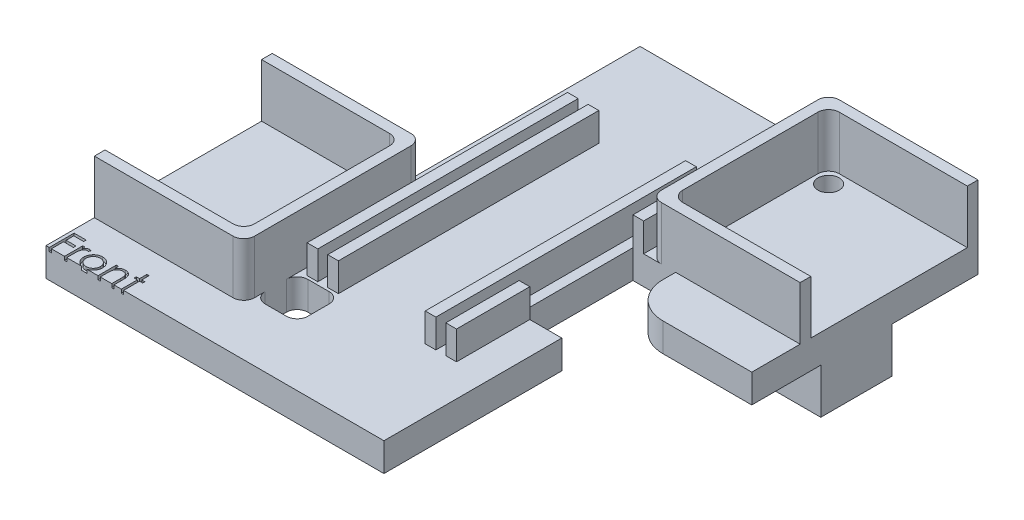
from build123d import *

# Parameters (mm, degrees)
BOSS_EXTRUDE1_DEPTH = 4
BOSS_EXTRUDE2_DEPTH = 7.5
BOSS_EXTRUDE3_DEPTH = 7.5
SKETCH6_R           = 1.5
CUT_EXTRUDE1_DEPTH  = 47.920144927
SKETCH7_W           = 1.5
SKETCH7_H           = 36.6
BOSS_EXTRUDE4_DEPTH = 4
SKETCH8_W           = 6
SKETCH8_H           = 16
CUT_EXTRUDE2_DEPTH  = 48.002659499
SKETCH12_W          = 10
SKETCH12_H          = 10
BOSS_EXTRUDE5_DEPTH = 6.35
CUT_EXTRUDE3_DEPTH  = 48.459166659
CUT_EXTRUDE4_DEPTH  = 0.5
FILLET1_R           = 5


with BuildPart() as part:
    # Sketch1 → Boss-Extrude1 (new body)
    with BuildSketch(Plane(origin=(0, 0, 0), x_dir=(1, 0, 0), z_dir=(0, 1, 0))):
        Polygon((-15, 33), (32.5, 33), (32.5, 1.2), (15, 1.2), (15, -33), (-32.5, -33), (-32.5, -1.2), (-15, -1.2), align=None)
    extrude(amount=BOSS_EXTRUDE1_DEPTH)

    # Sketch2 → Boss-Extrude2 (add)
    with BuildSketch(Plane(origin=(0, 4, 0), x_dir=(1, 0, 0), z_dir=(0, 1, 0))):
        with BuildLine():
            Line((32.5, 31.5), (14.5, 31.5))
            ThreePointArc((14.5, 31.5), (13.439339828, 31.060660172), (13, 30))
            Line((13, 30), (13, 11))
            ThreePointArc((13, 11), (13.439339828, 9.939339828), (14.5, 9.5))
            Line((14.5, 9.5), (32.5, 9.5))
            Line((32.5, 9.5), (32.5, 8))
            Line((32.5, 8), (13, 8))
            ThreePointArc((13, 8), (11.939339828, 8.439339828), (11.5, 9.5))
            Line((11.5, 9.5), (11.5, 31.5))
            ThreePointArc((11.5, 31.5), (11.939339828, 32.560660172), (13, 33))
            Line((13, 33), (32.5, 33))
            Line((32.5, 33), (32.5, 31.5))
        make_face()
    extrude(amount=BOSS_EXTRUDE2_DEPTH)

    # Sketch5 → Boss-Extrude3 (add)
    with BuildSketch(Plane(origin=(0, 4, 0), x_dir=(1, 0, 0), z_dir=(0, 1, 0))):
        with BuildLine():
            Line((-32.5, -2.7), (-14.5, -2.7))
            ThreePointArc((-14.5, -2.7), (-13.439339828, -3.139339828), (-13, -4.2))
            Line((-13, -4.2), (-13, -23.2))
            ThreePointArc((-13, -23.2), (-13.439339828, -24.260660172), (-14.5, -24.7))
            Line((-14.5, -24.7), (-32.5, -24.7))
            Line((-32.5, -24.7), (-32.5, -26.2))
            Line((-32.5, -26.2), (-13, -26.2))
            ThreePointArc((-13, -26.2), (-11.939339828, -25.760660172), (-11.5, -24.7))
            Line((-11.5, -24.7), (-11.5, -2.7))
            ThreePointArc((-11.5, -2.7), (-11.939339828, -1.639339828), (-13, -1.2))
            Line((-13, -1.2), (-32.5, -1.2))
            Line((-32.5, -1.2), (-32.5, -2.7))
        make_face()
    extrude(amount=BOSS_EXTRUDE3_DEPTH)

    # Sketch6 → Cut-Extrude1 (cut, through all)
    with BuildSketch(Plane(origin=(0, 4, 0), x_dir=(1, 0, 0), z_dir=(0, 1, 0))):
        with Locations(Location((-15, -22.7, 0), (0, 0, 270))):
            Circle(SKETCH6_R)
        with Locations(Location((15, 29.5, 0), (0, 0, 270))):
            Circle(SKETCH6_R)
    extrude(amount=-CUT_EXTRUDE1_DEPTH, mode=Mode.SUBTRACT)

    # Sketch7 → Boss-Extrude4 (add)
    with BuildSketch(Plane(origin=(0, 4, 0), x_dir=(1, 0, 0), z_dir=(0, 1, 0))):
        with Locations((-9.75, 0)):
            Rectangle(SKETCH7_W, SKETCH7_H)
        with Locations((-6.85, 0)):
            Rectangle(SKETCH7_W, SKETCH7_H)
        with Locations((6.85, 0)):
            Rectangle(SKETCH7_W, SKETCH7_H)
        with Locations((9.75, 0)):
            Rectangle(SKETCH7_W, SKETCH7_H)
    extrude(amount=BOSS_EXTRUDE4_DEPTH)

    # Sketch8 → Cut-Extrude2 (cut, through all)
    with BuildSketch(Plane(origin=(0, 8, 0), x_dir=(1, 0, 0), z_dir=(0, 1, 0))):
        with Locations((12, 0)):
            Rectangle(SKETCH8_W, SKETCH8_H)
    extrude(amount=-CUT_EXTRUDE2_DEPTH, mode=Mode.SUBTRACT)

    # Sketch12 → Boss-Extrude5 (add)
    with BuildSketch(Plane.XZ):
        with Locations((27.5, -15.9)):
            Rectangle(SKETCH12_W, SKETCH12_H)
        with Locations((-27.5, 18.3)):
            Rectangle(SKETCH12_W, SKETCH12_H)
    extrude(amount=BOSS_EXTRUDE5_DEPTH)

    # Sketch14 → Cut-Extrude3 (cut, through all)
    with BuildSketch(Plane(origin=(0, 4, 0), x_dir=(1, 0, 0), z_dir=(0, 1, 0))):
        with BuildLine():
            Line((-10, -18.7), (-7, -18.7))
            ThreePointArc((-7, -18.7), (-5.939339828, -19.139339828), (-5.5, -20.2))
            Line((-5.5, -20.2), (-5.5, -23.2))
            ThreePointArc((-5.5, -23.2), (-5.939339828, -24.260660172), (-7, -24.7))
            Line((-7, -24.7), (-10, -24.7))
            ThreePointArc((-10, -24.7), (-11.060660172, -24.260660172), (-11.5, -23.2))
            Line((-11.5, -23.2), (-11.5, -20.2))
            ThreePointArc((-11.5, -20.2), (-11.060660172, -19.139339828), (-10, -18.7))
        make_face()
        with BuildLine():
            Line((10, 18.7), (7, 18.7))
            ThreePointArc((7, 18.7), (5.939339828, 19.139339828), (5.5, 20.2))
            Line((5.5, 20.2), (5.5, 23.2))
            ThreePointArc((5.5, 23.2), (5.939339828, 24.260660172), (7, 24.7))
            Line((7, 24.7), (10, 24.7))
            ThreePointArc((10, 24.7), (11.060660172, 24.260660172), (11.5, 23.2))
            Line((11.5, 23.2), (11.5, 20.2))
            ThreePointArc((11.5, 20.2), (11.060660172, 19.139339828), (10, 18.7))
        make_face()
    extrude(amount=-CUT_EXTRUDE3_DEPTH, mode=Mode.SUBTRACT)

    # Sketch16 → Cut-Extrude4 (cut)
    # profile 1 of 5: a face of its own
    with BuildSketch(Plane(origin=(0, 4, 0), x_dir=(1, 0, 0), z_dir=(0, 1, 0))):
        Polygon((-32.051282051, -29.5), (-30.346153846, -29.5), (-30.346153846, -29.858974359), (-31.737179487, -29.858974359), (-31.737179487, -30.935897436), (-30.346153846, -30.935897436), (-30.346153846, -31.294871795), (-31.737179487, -31.294871795), (-31.737179487, -33), (-32.051282051, -33), align=None)
    # profile 2 of 5: a face of its own
    with BuildSketch(Plane(origin=(0, 4, 0), x_dir=(1, 0, 0), z_dir=(0, 1, 0))):
        with BuildLine():
            Line((-29.897435897, -30.442307692), (-29.583333333, -30.442307692))
            Line((-29.583333333, -30.442307692), (-29.583333333, -30.818810096))
            add(Edge.make_bspline(
                [(-29.583333333, -30.818810096), (-29.560144575, -30.783754268), (-29.515796254, -30.716710269), (-29.442083324, -30.628040968), (-29.366579993, -30.554625921), (-29.288924806, -30.496122402), (-29.208546706, -30.452309283), (-29.127209754, -30.420216248), (-29.043634284, -30.401238933), (-28.98747236, -30.398705274), (-28.959334936, -30.397435897)],
                knots=[0, 0, 0, 0, 1.2804753, 2.448899062, 3.506932113, 4.484331642, 5.4025378, 6.288909075, 7.142734305, 8, 8, 8, 8], degree=3))
            add(Edge.make_bspline(
                [(-28.959334936, -30.397435897), (-28.937508609, -30.398626424), (-28.892599524, -30.40107601), (-28.824616934, -30.418286835), (-28.754573482, -30.445764857), (-28.709431095, -30.47160508), (-28.685897436, -30.485076122)],
                knots=[0, 0, 0, 0, 0.901110191, 1.854092781, 2.881294221, 4, 4, 4, 4], degree=3))
            Line((-28.685897436, -30.485076122), (-28.858373397, -30.757111378))
            add(Edge.make_bspline(
                [(-28.858373397, -30.757111378), (-28.873482419, -30.750371112), (-28.902162233, -30.737576797), (-28.944116799, -30.722434787), (-28.982798136, -30.713518871), (-29.007441694, -30.712168153), (-29.018930288, -30.711538462)],
                knots=[0, 0, 0, 0, 1.180555205, 2.24091978, 3.179933427, 4, 4, 4, 4], degree=3))
            add(Edge.make_bspline(
                [(-29.018930288, -30.711538462), (-29.044136022, -30.713218499), (-29.095548412, -30.716645288), (-29.171032911, -30.743584096), (-29.244280117, -30.787109336), (-29.302451779, -30.835380448), (-29.347494032, -30.881928245), (-29.379634258, -30.922576648), (-29.409117005, -30.968155279), (-29.437287225, -31.017884963), (-29.462953519, -31.072614809), (-29.486908188, -31.131798023), (-29.508567051, -31.195503151), (-29.520917296, -31.239885672), (-29.52724359, -31.262620192)],
                knots=[0, 0, 0, 0, 1.125678352, 2.296057538, 3.5422874, 4.923748041, 5.663163013, 6.437101912, 7.23742474, 8.08941207, 8.991984279, 9.93940061, 10.944477711, 12, 12, 12, 12], degree=3))
            add(Edge.make_bspline(
                [(-29.52724359, -31.262620192), (-29.531975983, -31.282897366), (-29.542457875, -31.327809765), (-29.552649413, -31.403158289), (-29.562718931, -31.492181948), (-29.569815549, -31.595128541), (-29.576393591, -31.711740985), (-29.580103673, -31.84219693), (-29.583206814, -31.986630282), (-29.583289881, -32.087604635), (-29.583333333, -32.140424679)],
                knots=[0, 0, 0, 0, 0.566838948, 1.255505196, 2.06880316, 3.007127437, 4.065329342, 5.249902469, 6.561414163, 8, 8, 8, 8], degree=3))
            Line((-29.583333333, -32.140424679), (-29.583333333, -33))
            Line((-29.583333333, -33), (-29.897435897, -33))
            Line((-29.897435897, -33), (-29.897435897, -30.442307692))
        make_face()
    # profile 3 of 5: a face of its own
    with BuildSketch(Plane(origin=(0, 4, 0), x_dir=(1, 0, 0), z_dir=(0, 1, 0))):
        with BuildLine():
            add(Edge.make_bspline(
                [(-27.136418269, -30.397435897), (-27.088426996, -30.398457789), (-26.994327839, -30.400461467), (-26.856519953, -30.421876433), (-26.724974817, -30.454623797), (-26.599188625, -30.499895359), (-26.480772329, -30.56057731), (-26.368001085, -30.632986601), (-26.261184076, -30.718769195), (-26.197161047, -30.785127263), (-26.164663462, -30.818810096)],
                knots=[0, 0, 0, 0, 1.054011418, 2.066658804, 3.057071809, 4.030435133, 4.997543892, 5.974964718, 6.972108034, 8, 8, 8, 8], degree=3))
            add(Edge.make_bspline(
                [(-26.164663462, -30.818810096), (-26.136681507, -30.851024082), (-26.081259127, -30.914828624), (-26.010193408, -31.018284237), (-25.948971848, -31.125424338), (-25.899908887, -31.237671664), (-25.861223864, -31.354046336), (-25.833758167, -31.474948347), (-25.817421232, -31.600110694), (-25.815218265, -31.685114532), (-25.814102564, -31.728165064)],
                knots=[0, 0, 0, 0, 1.025258237, 2.030674902, 3.01204498, 3.988269485, 4.97094183, 5.956517959, 6.965070386, 8, 8, 8, 8], degree=3))
            add(Edge.make_bspline(
                [(-25.814102564, -31.728165064), (-25.815083901, -31.771465122), (-25.81702307, -31.857028055), (-25.835366686, -31.983047421), (-25.863897772, -32.105242244), (-25.90472961, -32.223100937), (-25.957087719, -32.336983765), (-26.020978407, -32.446393314), (-26.096850024, -32.551545447), (-26.182854021, -32.651547286), (-26.277905897, -32.7437135), (-26.381022045, -32.82404177), (-26.490176079, -32.892863294), (-26.606819432, -32.94829971), (-26.729886919, -32.99200941), (-26.859643987, -33.022709427), (-26.995889058, -33.04127111), (-27.088916279, -33.043654684), (-27.136418269, -33.044871795)],
                knots=[0, 0, 0, 0, 0.998656419, 1.973391657, 2.932242238, 3.890759089, 4.846373663, 5.82037756, 6.809684879, 7.83454468, 8.860553229, 9.859544525, 10.845671541, 11.83227036, 12.833544569, 13.85385346, 14.904124723, 16, 16, 16, 16], degree=3))
            add(Edge.make_bspline(
                [(-27.136418269, -33.044871795), (-27.184152989, -33.043650599), (-27.277643848, -33.041258824), (-27.41436983, -33.022781541), (-27.544359449, -32.992023559), (-27.667588048, -32.948156066), (-27.784732895, -32.892861522), (-27.894519392, -32.824249833), (-27.997719307, -32.743689678), (-28.092791292, -32.651553741), (-28.178789897, -32.551543784), (-28.254662905, -32.446393746), (-28.318553232, -32.336983652), (-28.370911435, -32.223100967), (-28.411743248, -32.105242236), (-28.440274341, -31.983047423), (-28.458617956, -31.857028055), (-28.460557124, -31.771465122), (-28.461538462, -31.728165064)],
                knots=[0, 0, 0, 0, 1.099876186, 2.154163076, 3.173186993, 4.173200201, 5.163417411, 6.152872554, 7.150605724, 8.17532212, 9.198891216, 10.186952605, 11.159729845, 12.11414092, 13.071450619, 14.029093627, 15.002601286, 16, 16, 16, 16], degree=3))
            add(Edge.make_bspline(
                [(-28.461538462, -31.728165064), (-28.460415151, -31.685348518), (-28.45819119, -31.600579116), (-28.441870681, -31.475652055), (-28.414512124, -31.354954666), (-28.375780728, -31.23902919), (-28.326265537, -31.127273754), (-28.265904249, -31.019868923), (-28.194113616, -30.916881123), (-28.138911665, -30.853159043), (-28.110977564, -30.820913462)],
                knots=[0, 0, 0, 0, 1.031353054, 2.041901799, 3.029428768, 4.008703097, 4.981709435, 5.96992636, 6.972712378, 8, 8, 8, 8], degree=3))
            add(Edge.make_bspline(
                [(-28.110977564, -30.820913462), (-28.078528973, -30.786938522), (-28.014713109, -30.720120826), (-27.907364381, -30.634588302), (-27.79487056, -30.560672228), (-27.675145634, -30.501196013), (-27.549462776, -30.454357495), (-27.417243534, -30.42179198), (-27.278968018, -30.400538625), (-27.184408397, -30.398480447), (-27.136418269, -30.397435897)],
                knots=[0, 0, 0, 0, 1.027980169, 2.021703884, 2.998553061, 3.971491411, 4.943284454, 5.930300938, 6.949603206, 8, 8, 8, 8], degree=3))
        make_face()
        with BuildLine():
            add(Edge.make_bspline(
                [(-27.137820513, -30.711538462), (-27.171758124, -30.712503053), (-27.238757253, -30.714407336), (-27.337376838, -30.72889124), (-27.432316991, -30.751838745), (-27.523757836, -30.784442801), (-27.611391008, -30.8265417), (-27.69530041, -30.87825006), (-27.77573285, -30.938883016), (-27.851114914, -31.008345688), (-27.920297226, -31.084224683), (-27.980775202, -31.165073041), (-28.032200309, -31.249579388), (-28.075040468, -31.337831599), (-28.106947656, -31.430724013), (-28.130120678, -31.527204644), (-28.144590919, -31.62747006), (-28.146477297, -31.695631079), (-28.147435897, -31.730268429)],
                knots=[0, 0, 0, 0, 1.021534396, 2.016698045, 2.994645724, 3.958388632, 4.93408049, 5.916473867, 6.921342795, 7.962252576, 8.998418191, 10.008913653, 10.997312074, 11.973003931, 12.956656626, 13.948281152, 14.957379055, 16, 16, 16, 16], degree=3))
            add(Edge.make_bspline(
                [(-28.147435897, -31.730268429), (-28.145829074, -31.775020457), (-28.142639829, -31.863844862), (-28.116704593, -31.994655985), (-28.073318313, -32.120237837), (-28.014731033, -32.239854223), (-27.941324815, -32.350526501), (-27.854837748, -32.449197985), (-27.756198048, -32.534383797), (-27.646581547, -32.605064642), (-27.528227229, -32.661224398), (-27.402970908, -32.701023374), (-27.272330214, -32.726895066), (-27.183049483, -32.729466541), (-27.137820513, -32.730769231)],
                knots=[0, 0, 0, 0, 1.016792936, 2.018143844, 3.017858371, 4.030088057, 5.03801393, 6.028138512, 7.003788237, 7.991172063, 8.984598303, 9.972568034, 10.972917682, 12, 12, 12, 12], degree=3))
            add(Edge.make_bspline(
                [(-27.137820513, -32.730769231), (-27.092594144, -32.729458951), (-27.003318548, -32.726872494), (-26.872859371, -32.701153674), (-26.747945399, -32.661050013), (-26.629714012, -32.605127803), (-26.520147408, -32.534115389), (-26.420798287, -32.449679012), (-26.335049676, -32.35026516), (-26.261716071, -32.239707631), (-26.202169328, -32.120423279), (-26.158986126, -31.994632807), (-26.132988541, -31.863850765), (-26.129807712, -31.775022434), (-26.128205128, -31.730268429)],
                knots=[0, 0, 0, 0, 1.02726834, 2.027799167, 3.010890988, 4.004497153, 4.992059811, 5.971914811, 6.958719428, 7.966827853, 8.981595046, 9.981490638, 10.983022906, 12, 12, 12, 12], degree=3))
            add(Edge.make_bspline(
                [(-26.128205128, -31.730268429), (-26.129163398, -31.695630872), (-26.131049127, -31.627469446), (-26.145524092, -31.527206993), (-26.168679631, -31.430715396), (-26.200651249, -31.337863393), (-26.243305262, -31.249350888), (-26.295722056, -31.165321161), (-26.355953081, -31.083944615), (-26.425970202, -31.008590974), (-26.50127358, -30.938855938), (-26.581738618, -30.878226548), (-26.665523597, -30.826768953), (-26.752902179, -30.784082712), (-26.844354747, -30.752135372), (-26.939161876, -30.728758741), (-27.037360686, -30.714468544), (-27.104119729, -30.712521402), (-27.137820513, -30.711538462)],
                knots=[0, 0, 0, 0, 1.042956736, 2.052379634, 3.044323526, 4.02829302, 5.004299113, 5.996692471, 7.007513377, 8.048758398, 9.090003419, 10.095195979, 11.07790575, 12.047570684, 13.018257071, 13.989683339, 14.985167495, 16, 16, 16, 16], degree=3))
        make_face(mode=Mode.SUBTRACT)
    # profile 4 of 5: a face of its own
    with BuildSketch(Plane(origin=(0, 4, 0), x_dir=(1, 0, 0), z_dir=(0, 1, 0))):
        with BuildLine():
            Line((-25.185897436, -30.442307692), (-24.871794872, -30.442307692))
            Line((-24.871794872, -30.442307692), (-24.871794872, -30.903645833))
            add(Edge.make_bspline(
                [(-24.871794872, -30.903645833), (-24.838257237, -30.86180311), (-24.773176286, -30.780605847), (-24.664791952, -30.673885272), (-24.550248052, -30.585940047), (-24.430246049, -30.515836253), (-24.304623038, -30.462989627), (-24.174144768, -30.424823696), (-24.038030062, -30.401938868), (-23.945465626, -30.398948637), (-23.898637821, -30.397435897)],
                knots=[0, 0, 0, 0, 1.12780773, 2.188550248, 3.19190651, 4.159438251, 5.104880172, 6.052711206, 7.014878035, 8, 8, 8, 8], degree=3))
            add(Edge.make_bspline(
                [(-23.898637821, -30.397435897), (-23.851307186, -30.399181093), (-23.758669719, -30.402596861), (-23.623791657, -30.429613552), (-23.497818264, -30.475758808), (-23.381198708, -30.538970878), (-23.276071494, -30.617577351), (-23.183746643, -30.709155133), (-23.107383396, -30.814491216), (-23.056186033, -30.912214373), (-23.022460385, -30.998903167), (-23.001228047, -31.073149917), (-22.983197066, -31.155868068), (-22.967565318, -31.246807657), (-22.956988206, -31.346605847), (-22.948645914, -31.454853539), (-22.94266722, -31.57151567), (-22.942430013, -31.652202297), (-22.942307692, -31.693810096)],
                knots=[0, 0, 0, 0, 1.235846778, 2.418850247, 3.575807741, 4.728682307, 5.871620074, 6.994088408, 8.11269785, 9.256955736, 9.865816715, 10.540099792, 11.271859618, 12.076849838, 12.949306005, 13.892391288, 14.913166135, 16, 16, 16, 16], degree=3))
            Line((-22.942307692, -31.693810096), (-22.942307692, -33))
            Line((-22.942307692, -33), (-23.256410256, -33))
            Line((-23.256410256, -33), (-23.256410256, -31.796875))
            add(Edge.make_bspline(
                [(-23.256410256, -31.796875), (-23.256603464, -31.762052555), (-23.256973038, -31.695443144), (-23.258138685, -31.600074121), (-23.260948492, -31.513587543), (-23.264896805, -31.436190175), (-23.270675835, -31.367956339), (-23.276698467, -31.308747062), (-23.284063443, -31.25863752), (-23.290626357, -31.228472437), (-23.293569712, -31.21494391)],
                knots=[0, 0, 0, 0, 1.430800155, 2.736877192, 3.918605307, 4.986035426, 5.920637409, 6.731861385, 7.431261377, 8, 8, 8, 8], degree=3))
            add(Edge.make_bspline(
                [(-23.293569712, -31.21494391), (-23.304195243, -31.175232725), (-23.324646104, -31.098800981), (-23.375180087, -30.995126628), (-23.438994268, -30.90692844), (-23.516892117, -30.834751719), (-23.608121193, -30.778580882), (-23.712428335, -30.739606927), (-23.828806976, -30.715230658), (-23.910661359, -30.712803526), (-23.953325321, -30.711538462)],
                knots=[0, 0, 0, 0, 1.084156227, 2.086665306, 3.027808233, 3.945421172, 4.874247719, 5.839848303, 6.874090471, 8, 8, 8, 8], degree=3))
            add(Edge.make_bspline(
                [(-23.953325321, -30.711538462), (-23.978593004, -30.712014466), (-24.028597097, -30.712956467), (-24.102747069, -30.722407765), (-24.174671242, -30.737866221), (-24.245091451, -30.758734858), (-24.312599245, -30.787397127), (-24.379363536, -30.819926498), (-24.4428703, -30.86047471), (-24.504473697, -30.905665331), (-24.561786505, -30.955744538), (-24.615114843, -31.008589048), (-24.662652864, -31.064864652), (-24.705721539, -31.1236646), (-24.742899802, -31.185796438), (-24.77535289, -31.250660744), (-24.802888585, -31.318342893), (-24.816571278, -31.365317954), (-24.823417468, -31.388822115)],
                knots=[0, 0, 0, 0, 1.023777757, 2.026029729, 3.023749952, 4.003683103, 4.997618607, 5.993177895, 7.010360494, 8.046726602, 9.087585522, 10.09234134, 11.086953743, 12.070360549, 13.043493632, 14.017870808, 15.008233677, 16, 16, 16, 16], degree=3))
            add(Edge.make_bspline(
                [(-24.823417468, -31.388822115), (-24.827357117, -31.406077318), (-24.835933525, -31.443640993), (-24.845196705, -31.505285412), (-24.853604281, -31.576595387), (-24.860641239, -31.657487704), (-24.864946656, -31.748245579), (-24.869641053, -31.848481417), (-24.871350114, -31.958594906), (-24.871642468, -32.035256598), (-24.871794872, -32.075220353)],
                knots=[0, 0, 0, 0, 0.615963638, 1.340920617, 2.168419149, 3.115676021, 4.16674242, 5.331190069, 6.6087489, 8, 8, 8, 8], degree=3))
            Line((-24.871794872, -32.075220353), (-24.871794872, -33))
            Line((-24.871794872, -33), (-25.185897436, -33))
            Line((-25.185897436, -33), (-25.185897436, -30.442307692))
        make_face()
    # profile 5 of 5: a face of its own
    with BuildSketch(Plane(origin=(0, 4, 0), x_dir=(1, 0, 0), z_dir=(0, 1, 0))):
        Polygon((-21.91025641, -29.41025641), (-21.596153846, -29.41025641), (-21.596153846, -30.442307692), (-21.147435897, -30.442307692), (-21.147435897, -30.756410256), (-21.596153846, -30.756410256), (-21.596153846, -33), (-21.91025641, -33), (-21.91025641, -30.756410256), (-22.358974359, -30.756410256), (-22.358974359, -30.442307692), (-21.91025641, -30.442307692), align=None)
    extrude(amount=-CUT_EXTRUDE4_DEPTH, mode=Mode.SUBTRACT)

    # Fillet1
    fillet1_edges = [part.edges().sort_by_distance(p)[0] for p in [
        (15, 2, -1.2),
    ]]
    fillet(fillet1_edges, radius=FILLET1_R)


solid = part.part
